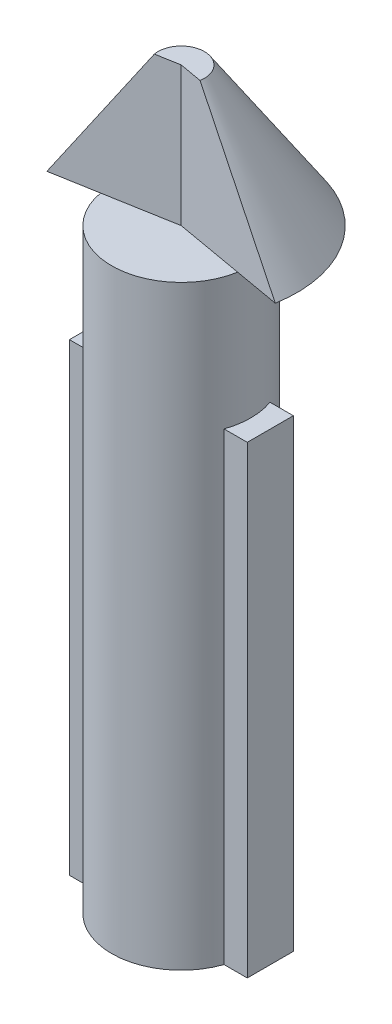
from build123d import *

# Parameters (mm, degrees)
SKETCH1_R                = 3
BOSS_EXTRUDE1_DEPTH      = 25.68
REVOLVE1_ANGLE           = 100
REVOLVE1_OTHER_WAY_ANGLE = 100
BOSS_EXTRUDE2_DEPTH      = 20


with BuildPart() as part:
    # Sketch1 → Boss-Extrude1 (new body)
    with BuildSketch(Plane(origin=(0, 0, 0), x_dir=(1, 0, 0), z_dir=(0, 1, 0))):
        with Locations(Location((0, 0, 0), (0, 0, 90))):
            Circle(SKETCH1_R)
    extrude(amount=BOSS_EXTRUDE1_DEPTH)

    # Sketch3 → Revolve1 (revolve)
    with BuildSketch(Plane(origin=(0, 0, 0), x_dir=(0, 0, -1), z_dir=(1, 0, 0))):
        Polygon((1, 31.68), (5, 25.68), (0, 25.68), (0, 31.68), align=None)
    revolve(axis=Axis((0, 25.68, 0), (0, 1, 0)), revolution_arc=REVOLVE1_ANGLE)

    # Sketch3 → Revolve1 other way (revolve)
    with BuildSketch(Plane(origin=(0, 0, 0), x_dir=(0, 0, -1), z_dir=(1, 0, 0))):
        Polygon((1, 31.68), (5, 25.68), (0, 25.68), (0, 31.68), align=None)
    revolve(axis=Axis((0, 25.68, 0), (0, -1, 0)), revolution_arc=REVOLVE1_OTHER_WAY_ANGLE)

    # Sketch4 → Boss-Extrude2 (add)
    with BuildSketch(Plane(origin=(0, 0, 0), x_dir=(-1, 0, 0), z_dir=(0, -1, 0))):
        with BuildLine():
            ThreePointArc((2.833333333, -0.986013297), (2.999990846, 0.007411119), (2.828427125, 1))
            Line((2.828427125, 1), (3.833333333, 1))
            Line((3.833333333, 1), (3.833333333, -0.986013297))
            Line((3.833333333, -0.986013297), (2.833333333, -0.986013297))
        make_face()
        with BuildLine():
            Line((-3.833333333, -0.986013297), (-2.833333333, -0.986013297))
            ThreePointArc((-2.833333333, -0.986013297), (-2.999990846, 0.007411119), (-2.828427125, 1))
            Line((-2.828427125, 1), (-3.833333333, 1))
            Line((-3.833333333, 1), (-3.833333333, -0.986013297))
        make_face()
    extrude(amount=-BOSS_EXTRUDE2_DEPTH)


solid = part.part
